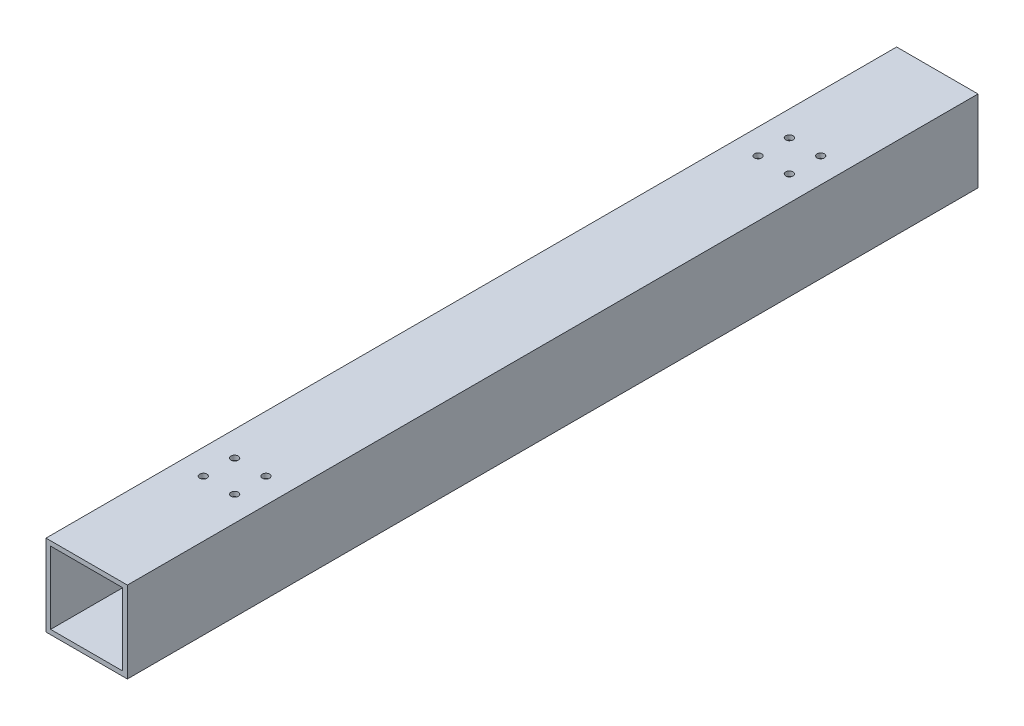
from build123d import *

# Parameters (mm, degrees)
SKETCH1_W               = 34.925
SKETCH1_H               = 34.925
SKETCH1_W_2             = 30.9626
SKETCH1_H_2             = 30.9626
BOSS_EXTRUDE1_DEPTH     = 182.5625
CUT_EXTRUDE1_DEPTH      = 185.22525402
CUT_EXTRUDE1_DEPTH_BACK = 185.22525402
SKETCH2_R               = 1.56250005


with BuildPart() as part:
    # Sketch1 → Boss-Extrude1 (new, symmetric)
    with BuildSketch(Plane.XY):
        Rectangle(SKETCH1_W, SKETCH1_H)
        Rectangle(SKETCH1_W_2, SKETCH1_H_2, mode=Mode.SUBTRACT)
    extrude(amount=BOSS_EXTRUDE1_DEPTH, both=True)

    # Sketch2 → Cut-Extrude1 (cut, two sides: drawn at the far end of the back side and taken through both)
    with BuildSketch(Plane(origin=(0, 0, 0), x_dir=(1, 0, 0), z_dir=(0, 1, 0)).offset(-CUT_EXTRUDE1_DEPTH_BACK)):
        with Locations(Location((-6.717514421, 125.780014421, 0), (0, 0, 270))):
            Circle(SKETCH2_R)
        with Locations(Location((6.717514421, 125.780014421, 0), (0, 0, 270))):
            Circle(SKETCH2_R)
        with Locations(Location((6.717514421, 112.344985579, 0), (0, 0, 270))):
            Circle(SKETCH2_R)
        with Locations(Location((-6.717514421, 112.344985579, 0), (0, 0, 270))):
            Circle(SKETCH2_R)
        with Locations(Location((-6.717514421, -112.344985579, 0), (0, 0, 270))):
            Circle(SKETCH2_R)
        with Locations(Location((6.717514421, -112.344985579, 0), (0, 0, 270))):
            Circle(SKETCH2_R)
        with Locations(Location((6.717514421, -125.780014421, 0), (0, 0, 270))):
            Circle(SKETCH2_R)
        with Locations(Location((-6.717514421, -125.780014421, 0), (0, 0, 270))):
            Circle(SKETCH2_R)
    extrude(amount=CUT_EXTRUDE1_DEPTH + CUT_EXTRUDE1_DEPTH_BACK, mode=Mode.SUBTRACT)


solid = part.part
